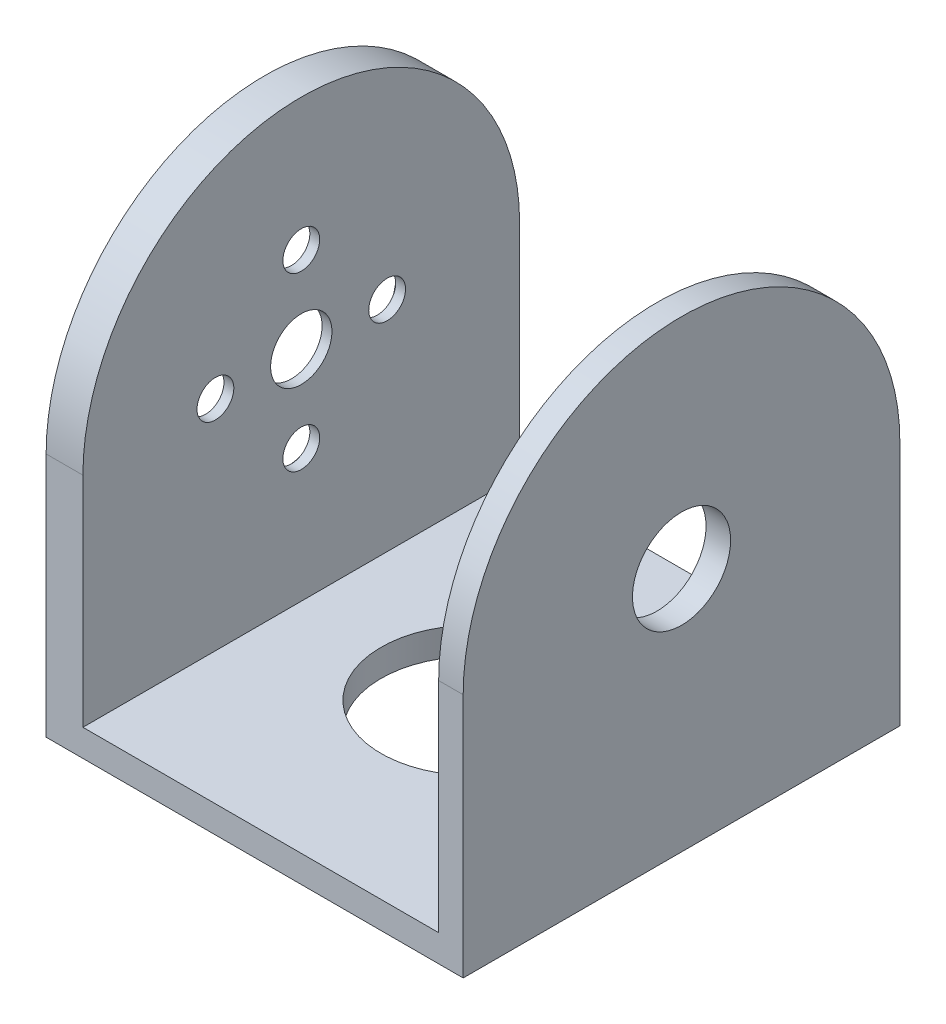
from build123d import *

# Parameters (mm, degrees)
SKETCH1_W               = 34
SKETCH1_H               = 35.6
BOSS_EXTRUDE1_DEPTH     = 2.2
BOSS_EXTRUDE2_DEPTH     = 3
BOSS_EXTRUDE3_START     = -32
BOSS_EXTRUDE3_DEPTH     = 2
SKETCH4_R               = 2.5
SKETCH4_R_2             = 1.5
CUT_EXTRUDE1_DEPTH      = 12
SKETCH4_3_R             = 10.925
SKETCH4_3_R_2           = 1.5
SKETCH4_3_R_3           = 2.5
CUT_EXTRUDE2_DEPTH      = 2.2
SKETCH5_R               = 4
CUT_EXTRUDE3_DEPTH      = 12.2
CUT_EXTRUDE4_DEPTH      = 46.107427326
CUT_EXTRUDE4_DEPTH_BACK = 46.107427326
SKETCH6_R               = 7.5


with BuildPart() as part:
    # Sketch1 → Boss-Extrude1 (new body)
    with BuildSketch(Plane(origin=(0, 0, 0), x_dir=(1, 0, 0), z_dir=(0, 1, 0))):
        Rectangle(SKETCH1_W, SKETCH1_H)
    extrude(amount=BOSS_EXTRUDE1_DEPTH)

    # Sketch3 → Boss-Extrude2 (add)
    with BuildSketch(Plane.ZY.offset(17)):
        with BuildLine():
            Line((0, 37.8), (0, 2.2))
            Line((0, 2.2), (17.8, 2.2))
            Line((17.8, 2.2), (17.8, 20))
            ThreePointArc((17.8, 20), (12.586500705, 32.586500705), (0, 37.8))
        make_face()
        with BuildLine():
            Line((-17.8, 2.2), (0, 2.2))
            Line((0, 2.2), (0, 37.8))
            ThreePointArc((0, 37.8), (-12.586500705, 32.586500705), (-17.8, 20))
            Line((-17.8, 20), (-17.8, 2.2))
        make_face()
    extrude(amount=-BOSS_EXTRUDE2_DEPTH)

    # Sketch3<4> → Boss-Extrude3 (add)
    with BuildSketch(Plane.ZY.offset(17).offset(BOSS_EXTRUDE3_START)):
        with BuildLine():
            Line((-17.8, 2.2), (0, 2.2))
            Line((0, 2.2), (0, 37.8))
            ThreePointArc((0, 37.8), (-12.586500705, 32.586500705), (-17.8, 20))
            Line((-17.8, 20), (-17.8, 2.2))
        make_face()
        with BuildLine():
            Line((0, 37.8), (0, 2.2))
            Line((0, 2.2), (17.8, 2.2))
            Line((17.8, 2.2), (17.8, 20))
            ThreePointArc((17.8, 20), (12.586500705, 32.586500705), (0, 37.8))
        make_face()
    extrude(amount=-BOSS_EXTRUDE3_DEPTH)

    # Sketch4 → Cut-Extrude1 (cut)
    with BuildSketch(Plane.ZY.offset(17)):
        with Locations((0, 20)):
            Circle(SKETCH4_R)
        with Locations((7, 20)):
            Circle(SKETCH4_R_2)
        with Locations((0, 27)):
            Circle(SKETCH4_R_2)
        with Locations((-7, 20)):
            Circle(SKETCH4_R_2)
        with Locations((0, 13)):
            Circle(SKETCH4_R_2)
    extrude(amount=-CUT_EXTRUDE1_DEPTH, mode=Mode.SUBTRACT)

    # Sketch4<3> → Cut-Extrude2 (cut)
    with BuildSketch(Plane.ZY.offset(17)):
        with Locations((0, 20)):
            Circle(SKETCH4_3_R)
        with Locations((0, 27)):
            Circle(SKETCH4_3_R_2, mode=Mode.SUBTRACT)
        with Locations((0, 13)):
            Circle(SKETCH4_3_R_2, mode=Mode.SUBTRACT)
        with Locations((-7, 20)):
            Circle(SKETCH4_3_R_2, mode=Mode.SUBTRACT)
        with Locations((7, 20)):
            Circle(SKETCH4_3_R_2, mode=Mode.SUBTRACT)
        with Locations((0, 20)):
            Circle(SKETCH4_3_R_3, mode=Mode.SUBTRACT)
    extrude(amount=-CUT_EXTRUDE2_DEPTH, mode=Mode.SUBTRACT)

    # Sketch5 → Cut-Extrude3 (cut)
    with BuildSketch(Plane(origin=(17, 0, 0), x_dir=(0, 0, -1), z_dir=(1, 0, 0))):
        with Locations((0, 20)):
            Circle(SKETCH5_R)
    extrude(amount=-CUT_EXTRUDE3_DEPTH, mode=Mode.SUBTRACT)

    # Sketch6 → Cut-Extrude4 (cut, two sides: drawn at the far end of the back side and taken through both)
    with BuildSketch(Plane.XZ.offset(-CUT_EXTRUDE4_DEPTH_BACK)):
        with Locations(Location((0, 0, 0), (0, 0, 270))):
            Circle(SKETCH6_R)
    extrude(amount=CUT_EXTRUDE4_DEPTH + CUT_EXTRUDE4_DEPTH_BACK, mode=Mode.SUBTRACT)


solid = part.part
